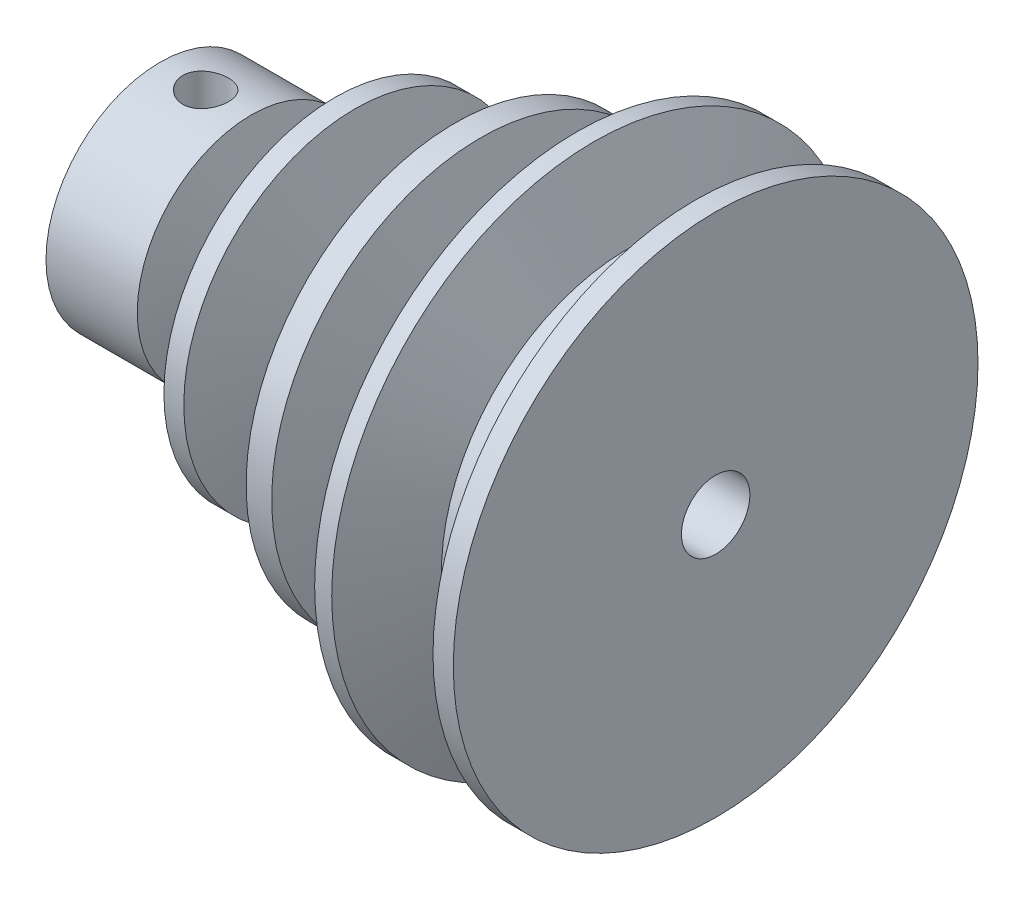
from build123d import *

# Parameters (mm, degrees)
SKETCH2_R          = 3
CUT_EXTRUDE1_DEPTH = 23.5


with BuildPart() as part:
    # Sketch1 → Revolve1 (revolve)
    with BuildSketch(Plane.XY, mode=Mode.PRIVATE) as revolve1_sk:
        Polygon((-73.063744965, 4.5), (0, 4.5), (0, 34.5), (-2.67228246, 34.5), (-5.556499615, 24.5), (-11.556499615, 24.5), (-15.990247298, 34.5), (-18.237315581, 34.5), (-18.237315581, 27.5), (-19.962759183, 27.5), (-22.377341153, 18.5), (-28.377341153, 18.5), (-30.883350481, 27.5), (-34.250598113, 27.5), (-34.250598113, 22.5), (-35.976041715, 22.5), (-38.65891057, 12.5), (-44.65891057, 12.5), (-47.443365379, 22.5), (-50.057907164, 22.5), (-50.057907164, 15), (-51.783350766, 15), (-53.393072079, 9), (-59.393072079, 9), (-61.063744965, 15), (-73.063744965, 15), align=None)
    revolve(revolve1_sk.sketch.rotate(Axis((0, 0, 0), (-1, 0, 0)), 90), axis=Axis((0, 0, 0), (-1, 0, 0)))

    # Sketch2 → Cut-Extrude1 (cut, symmetric)
    with BuildSketch(Plane(origin=(0, 0, 0), x_dir=(1, 0, 0), z_dir=(0, 1, 0))):
        with Locations(Location((-67.063744965, 0, 0), (0, 0, 270))):
            Circle(SKETCH2_R)
    extrude(amount=CUT_EXTRUDE1_DEPTH, both=True, mode=Mode.SUBTRACT)


solid = part.part
